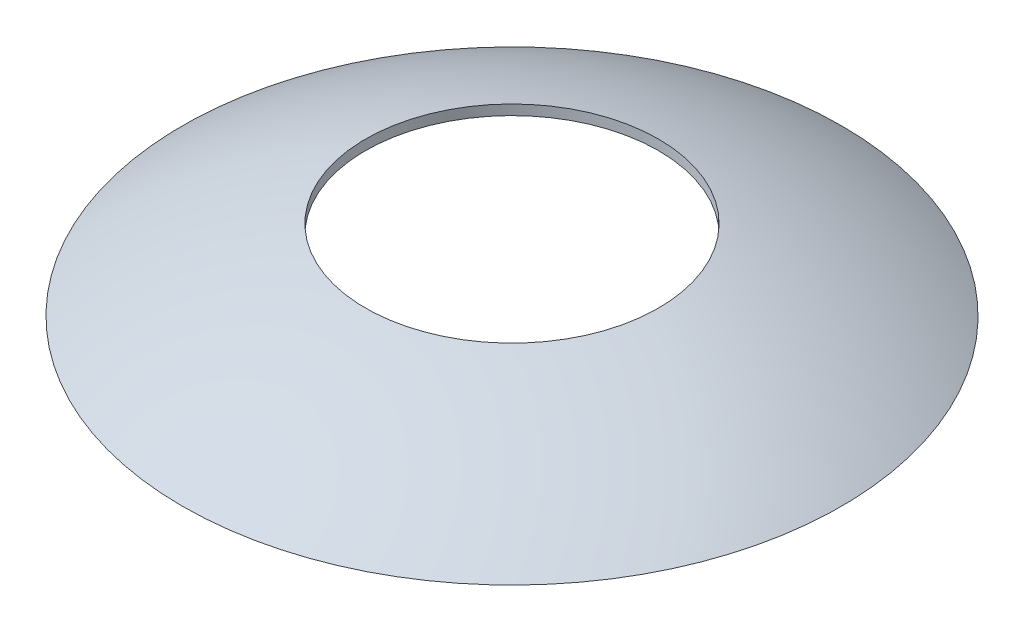
from build123d import *


with BuildPart() as part:
    # Sketch1 → Revolve1 (revolve)
    with BuildSketch(Plane.XY, mode=Mode.PRIVATE) as revolve1_sk:
        with BuildLine():
            Line((3, 1.433566306), (3, 1.639760556))
            ThreePointArc((3, 1.639760556), (4.944258563, 0.97826902), (6.75, 0))
            Line((6.75, 0), (6.37813587, 0))
            ThreePointArc((6.37813587, 0), (4.744196011, 0.846690035), (3, 1.433566306))
        make_face()
    revolve(revolve1_sk.sketch.rotate(Axis((0, 0, 0), (0, 1, 0)), 90), axis=Axis((0, 0, 0), (0, 1, 0)))


solid = part.part
